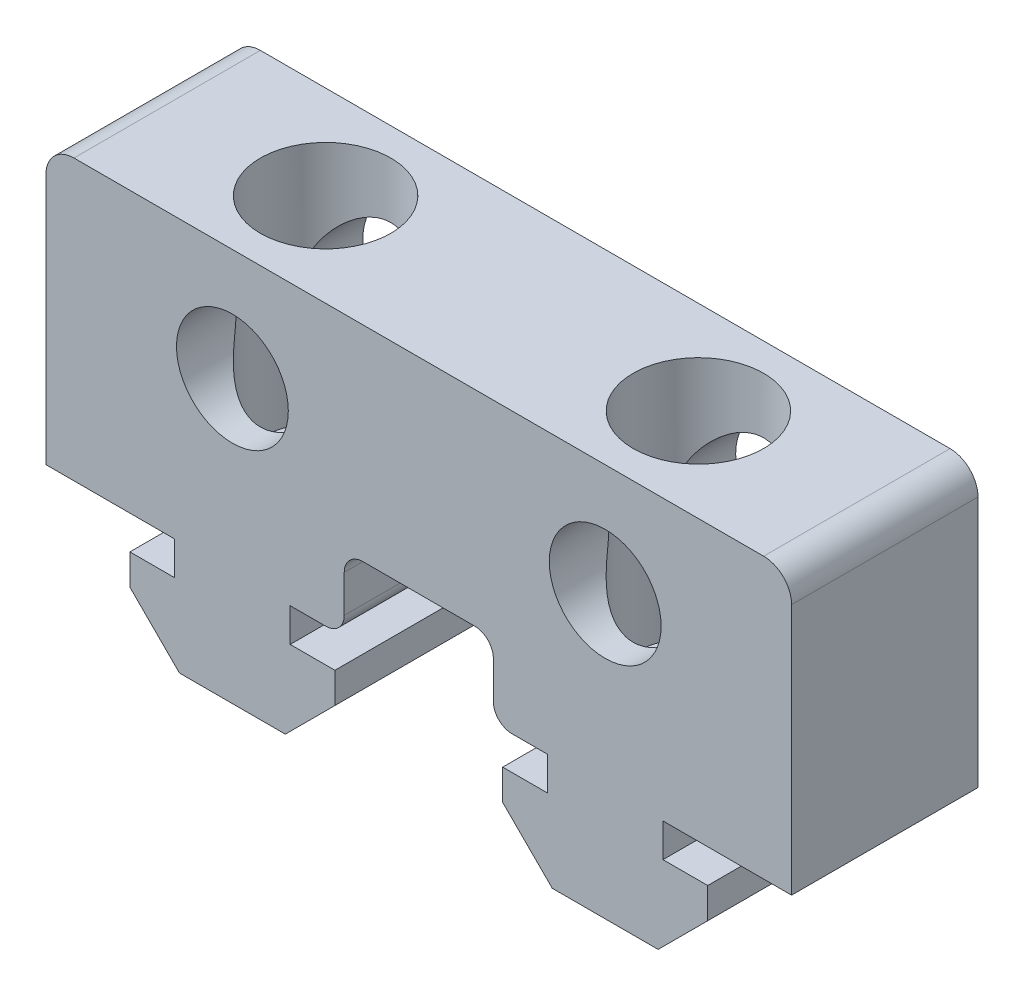
from build123d import *

# Parameters (mm, degrees)
SKETCH_1_W          = 40
SKETCH_1_H          = 15
SKETCH_1_R          = 3
EXTRUDE_1_DEPTH     = 10
EXTRUDE_2_DEPTH     = 10
FILLET_1_R          = 1.5
SKETCH_5_R          = 3.5
CUT_EXTRUDE_1_DEPTH = 13
SKETCH_6_R          = 1.75
CUT_EXTRUDE_2_DEPTH = 13
CUT_EXTRUDE_3_DEPTH = 13
FILLET_2_R          = 1


with BuildPart() as part:
    # 草图1 → 凸台-拉伸1 (new body)
    with BuildSketch(Plane.XY):
        with Locations((0, 7.5)):
            Rectangle(SKETCH_1_W, SKETCH_1_H)
        with Locations((-10, 9)):
            Circle(SKETCH_1_R, mode=Mode.SUBTRACT)
        with Locations((10, 9)):
            Circle(SKETCH_1_R, mode=Mode.SUBTRACT)
    extrude(amount=EXTRUDE_1_DEPTH)

    # 草图4 → 凸台-拉伸2 (add)
    with BuildSketch(Plane.XY.offset(10)):
        Polygon((-6.9, -1.8), (-6.9, 0), (-13.1, 0), (-13.1, -1.8), (-15.5, -1.8), (-15.5, -3.439339828), (-12.839339828, -6.1), (-7.160660172, -6.1), (-4.5, -3.439339828), (-4.5, -1.8), align=None)
        Polygon((13.1, -1.8), (13.1, 0), (6.9, 0), (6.9, -1.8), (4.5, -1.8), (4.5, -3.439339828), (7.160660172, -6.1), (12.839339828, -6.1), (15.5, -3.439339828), (15.5, -1.8), align=None)
    extrude(amount=-EXTRUDE_2_DEPTH)

    # 圆角1
    fillet_1_edges = [part.edges().sort_by_distance(p)[0] for p in [
        (20, 15, 5),
        (-20, 15, 5),
    ]]
    fillet(fillet_1_edges, radius=FILLET_1_R)

    # 草图5 → 切除-拉伸1 (cut)
    with BuildSketch(Plane(origin=(0, 15, 0), x_dir=(1, 0, 0), z_dir=(0, 1, 0))):
        with Locations(Location((-10, -5, 0), (0, 0, 270))):
            Circle(SKETCH_5_R)
        with Locations(Location((10, -5, 0), (0, 0, 270))):
            Circle(SKETCH_5_R)
    extrude(amount=-CUT_EXTRUDE_1_DEPTH, mode=Mode.SUBTRACT)

    # 草图6 → 切除-拉伸2 (cut)
    with BuildSketch(Plane(origin=(0, 2, 0), x_dir=(1, 0, 0), z_dir=(0, 1, 0))):
        with Locations(Location((10, -5, 0), (0, 0, 270))):
            Circle(SKETCH_6_R)
        with Locations(Location((-10, -5, 0), (0, 0, 270))):
            Circle(SKETCH_6_R)
    extrude(amount=-CUT_EXTRUDE_2_DEPTH, mode=Mode.SUBTRACT)

    # 草图7 → 切除-拉伸3 (cut)
    with BuildSketch(Plane.XY.offset(10)):
        Polygon((0, 4), (-4, 4), (-4, 0), (4, 0), (4, 4), align=None)
    extrude(amount=-CUT_EXTRUDE_3_DEPTH, mode=Mode.SUBTRACT)

    # 圆角2
    fillet_2_edges = [part.edges().sort_by_distance(p)[0] for p in [
        (4, 4, 5),
        (4, 0, 5),
        (-4, 0, 5),
        (-4, 4, 5),
    ]]
    fillet(fillet_2_edges, radius=FILLET_2_R)


solid = part.part
